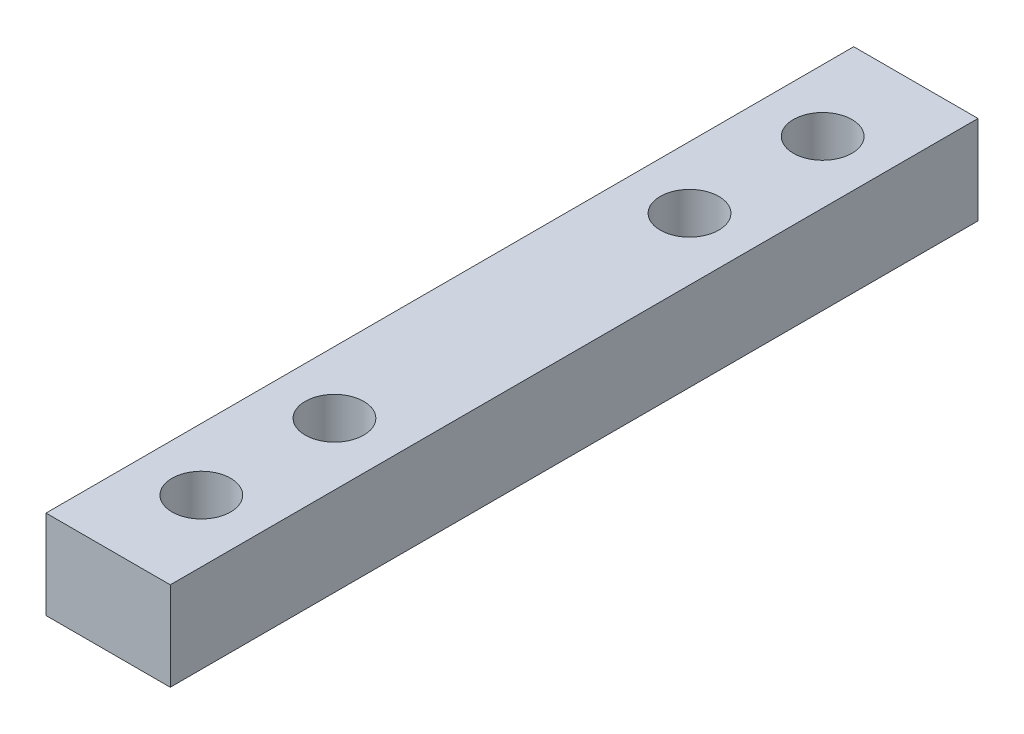
from build123d import *

# Parameters (mm, degrees)
SKETCH_1_W          = 7
SKETCH_1_H          = 45.5
EXTRUDE_1_DEPTH     = 5
CUT_EXTRUDE_1_REACH = 25.554
SKETCH_2_R          = 1.65
CUT_EXTRUDE_2_REACH = 25.554
SKETCH_3_R          = 1.65


with BuildPart() as part:
    # 草图1 → 凸台-拉伸1 (new body)
    with BuildSketch(Plane(origin=(0, 0, 0), x_dir=(1, 0, 0), z_dir=(0, 1, 0))):
        Rectangle(SKETCH_1_W, SKETCH_1_H)
    extrude(amount=EXTRUDE_1_DEPTH)

    # 草图2 → 切除-拉伸1 (cut, up to next)
    with BuildSketch(Plane(origin=(0, 5, 0), x_dir=(1, 0, 0), z_dir=(0, 1, 0)), mode=Mode.PRIVATE) as cut_extrude_1_sk1:
        with Locations(Location((0, 17.5, 0), (0, 0, 270))):
            Circle(SKETCH_2_R)
    cut_extrude_1_tool1 = extrude(cut_extrude_1_sk1.sketch, amount=-CUT_EXTRUDE_1_REACH, mode=Mode.PRIVATE) & part.part
    # 草图2 → 切除-拉伸1 (cut, up to next)
    with BuildSketch(Plane(origin=(0, 5, 0), x_dir=(1, 0, 0), z_dir=(0, 1, 0)), mode=Mode.PRIVATE) as cut_extrude_1_sk2:
        with Locations(Location((0, -17.5, 0), (0, 0, 270))):
            Circle(SKETCH_2_R)
    cut_extrude_1_tool2 = extrude(cut_extrude_1_sk2.sketch, amount=-CUT_EXTRUDE_1_REACH, mode=Mode.PRIVATE) & part.part
    add(cut_extrude_1_tool1.solids().sort_by_distance((0, 5, -17.5))[0], mode=Mode.SUBTRACT)
    add(cut_extrude_1_tool2.solids().sort_by_distance((0, 5, 17.5))[0], mode=Mode.SUBTRACT)

    # 草图3 → 切除-拉伸2 (cut, up to next)
    with BuildSketch(Plane(origin=(0, 5, 0), x_dir=(1, 0, 0), z_dir=(0, 1, 0)), mode=Mode.PRIVATE) as cut_extrude_2_sk1:
        with Locations(Location((0, 10, 0), (0, 0, 270))):
            Circle(SKETCH_3_R)
    cut_extrude_2_tool1 = extrude(cut_extrude_2_sk1.sketch, amount=-CUT_EXTRUDE_2_REACH, mode=Mode.PRIVATE) & part.part
    # 草图3 → 切除-拉伸2 (cut, up to next)
    with BuildSketch(Plane(origin=(0, 5, 0), x_dir=(1, 0, 0), z_dir=(0, 1, 0)), mode=Mode.PRIVATE) as cut_extrude_2_sk2:
        with Locations(Location((0, -10, 0), (0, 0, 270))):
            Circle(SKETCH_3_R)
    cut_extrude_2_tool2 = extrude(cut_extrude_2_sk2.sketch, amount=-CUT_EXTRUDE_2_REACH, mode=Mode.PRIVATE) & part.part
    add(cut_extrude_2_tool1.solids().sort_by_distance((0, 5, -10))[0], mode=Mode.SUBTRACT)
    add(cut_extrude_2_tool2.solids().sort_by_distance((0, 5, 10))[0], mode=Mode.SUBTRACT)


solid = part.part
